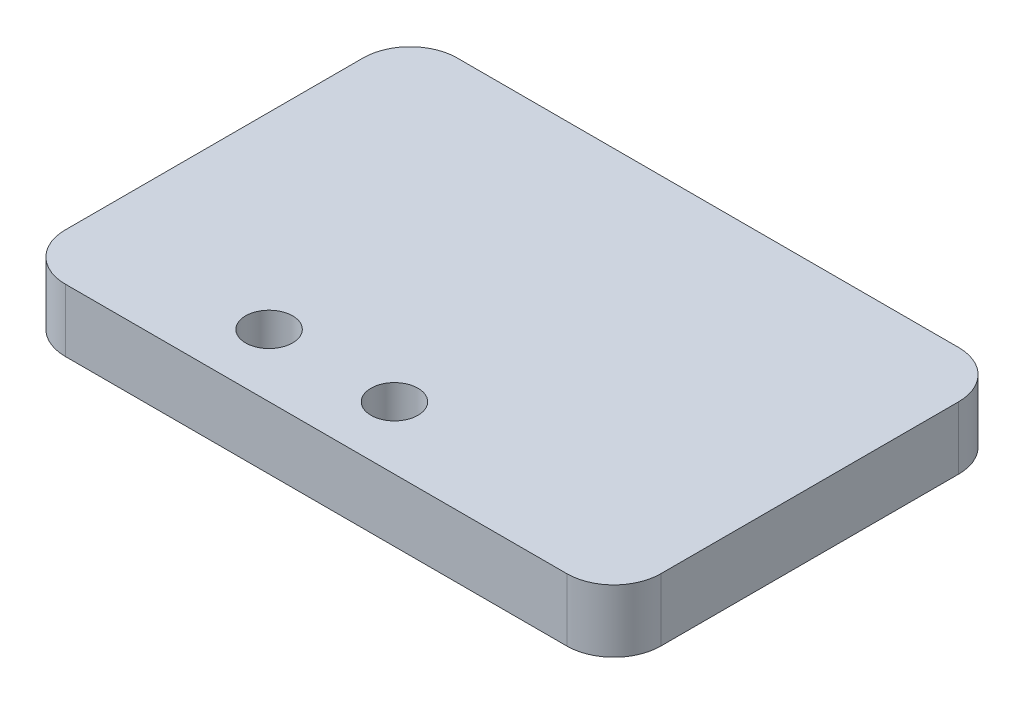
from build123d import *

# Parameters (mm, degrees)
SKETCH_1_W      = 38
SKETCH_1_H      = 25
SKETCH_1_R      = 1.5
EXTRUDE_1_DEPTH = 4
FILLET_1_R      = 3


with BuildPart() as part:
    # 草图1 → 凸台-拉伸1 (new body)
    with BuildSketch(Plane(origin=(0, 0, 0), x_dir=(1, 0, 0), z_dir=(0, 1, 0))):
        Rectangle(SKETCH_1_W, SKETCH_1_H)
        with Locations(Location((-7, -8.5, 0), (0, 0, 270))):
            Circle(SKETCH_1_R, mode=Mode.SUBTRACT)
        with Locations(Location((1, -8.5, 0), (0, 0, 270))):
            Circle(SKETCH_1_R, mode=Mode.SUBTRACT)
    extrude(amount=EXTRUDE_1_DEPTH)

    # 圆角1
    fillet_1_edges = [part.edges().sort_by_distance(p)[0] for p in [
        (-19, 2, 12.5),
        (-19, 2, -12.5),
        (19, 2, -12.5),
        (19, 2, 12.5),
    ]]
    fillet(fillet_1_edges, radius=FILLET_1_R)


solid = part.part
